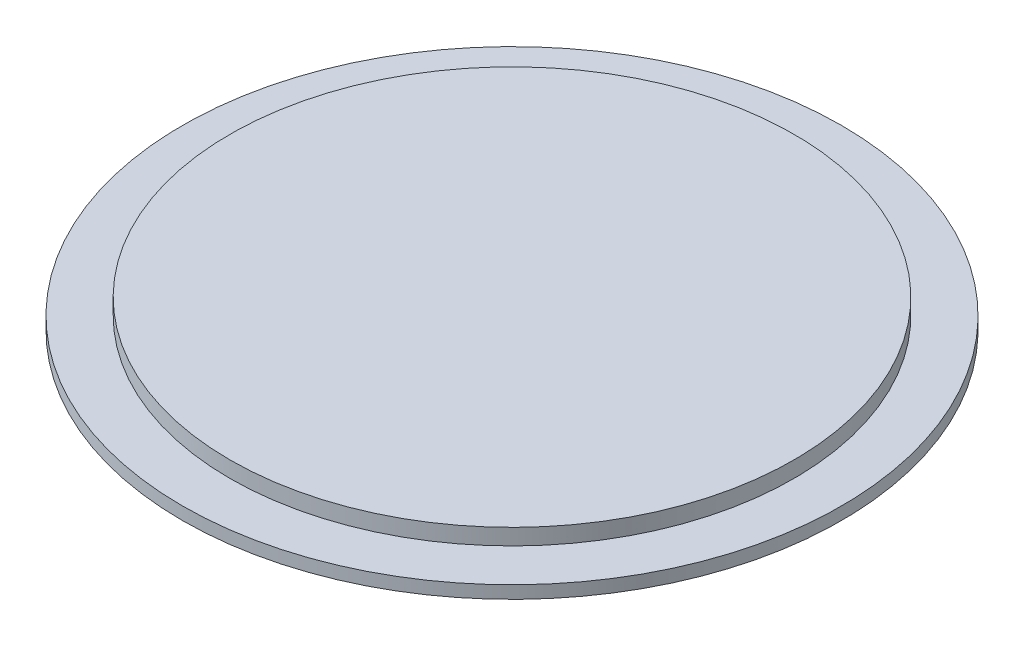
from build123d import *

# Parameters (mm, degrees)
SKETCH1_R           = 52
BOSS_EXTRUDE1_DEPTH = 2
SKETCH2_R           = 44.5
BOSS_EXTRUDE2_DEPTH = 2.54


with BuildPart() as part:
    # Sketch1 → Boss-Extrude1 (new body)
    with BuildSketch(Plane(origin=(0, 0, 0), x_dir=(1, 0, 0), z_dir=(0, 1, 0))):
        with Locations(Location((0, 0, 0), (0, 0, 270))):
            Circle(SKETCH1_R)
    extrude(amount=BOSS_EXTRUDE1_DEPTH)

    # Sketch2 → Boss-Extrude2 (add)
    with BuildSketch(Plane(origin=(0, 2, 0), x_dir=(1, 0, 0), z_dir=(0, 1, 0))):
        with Locations(Location((0, 0, 0), (0, 0, 270))):
            Circle(SKETCH2_R)
    extrude(amount=BOSS_EXTRUDE2_DEPTH)


solid = part.part
